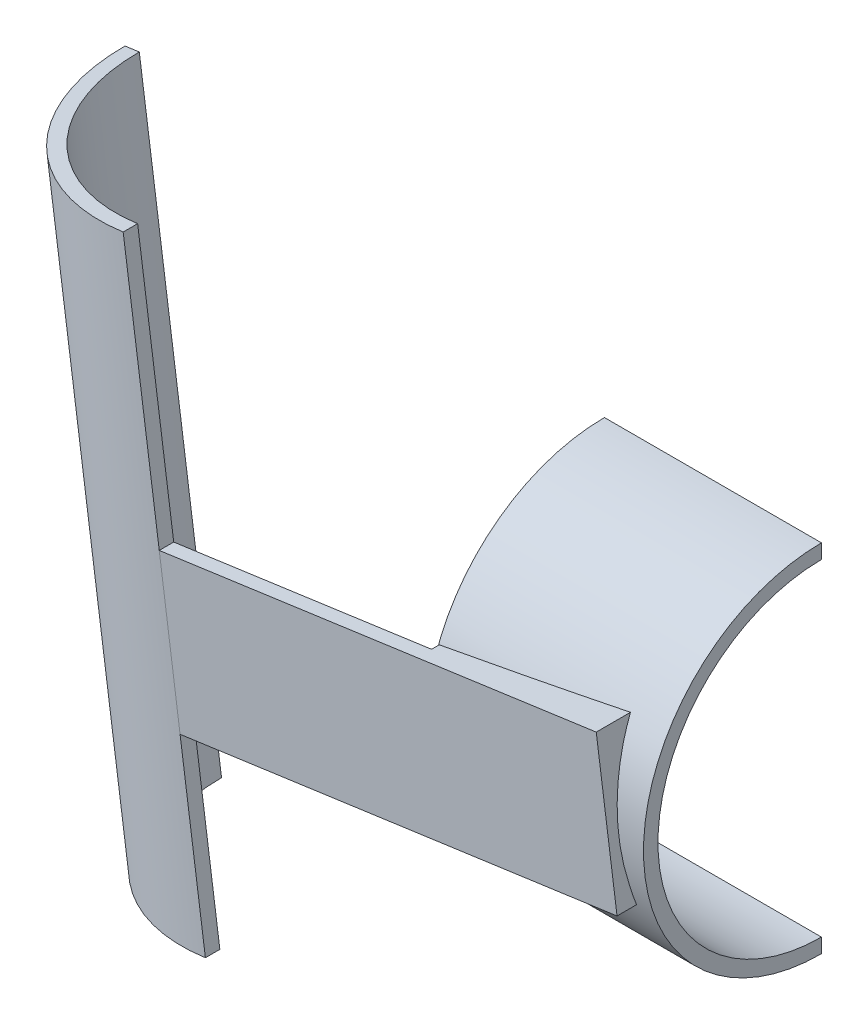
from build123d import *

# Parameters (mm, degrees)
SKETCH3_R               = 26
SKETCH3_R_2             = 24
BOSS_EXTRUDE1_DEPTH     = 82
SKETCH2_R               = 24.6
SKETCH2_R_2             = 22.6
BOSS_EXTRUDE2_DEPTH     = 30
CUT_EXTRUDE1_DEPTH      = 30
CUT_EXTRUDE1_DEPTH_BACK = 30
SKETCH5_W               = 101.816386604
SKETCH5_H               = 90.816460778
CUT_EXTRUDE2_DEPTH      = 30
SKETCH6_W               = 2
SKETCH6_H               = 20.775230247
BOSS_EXTRUDE3_DEPTH     = 61
BOSS_EXTRUDE5_DEPTH     = 25
CUT_EXTRUDE3_START      = -32
SKETCH8_R               = 22.6
CUT_EXTRUDE3_DEPTH      = 32


with BuildPart() as part:
    # Sketch3 → Boss-Extrude1 (new body)
    with BuildSketch(Plane(origin=(-103.870896529, 742.017814767, 0), x_dir=(-0.9903438719336157, -0.13863266326351154, 0), z_dir=(0.13863266326351156, -0.9903438719336158, 0))):
        with Locations((-535.354479902, 0)):
            Circle(SKETCH3_R)
        with Locations((-535.354479902, 0)):
            Circle(SKETCH3_R_2, mode=Mode.SUBTRACT)
    extrude(amount=-BOSS_EXTRUDE1_DEPTH)

    # Sketch4 → Cut-Extrude1 (cut, two sides: drawn at the far end of the back side and taken through both)
    with BuildSketch(Plane.XY.offset(-CUT_EXTRUDE1_DEPTH_BACK)):
        Polygon((414.924769966, 897.597101018), (426.314131953, 816.235432106), (452.063072624, 819.839881351), (440.673710637, 901.201550263), align=None)
    extrude(amount=CUT_EXTRUDE1_DEPTH + CUT_EXTRUDE1_DEPTH_BACK, mode=Mode.SUBTRACT)


with BuildPart() as body_2:
    # Sketch2 → Boss-Extrude2 (new body)
    with BuildSketch(Plane(origin=(455.481917253, 0, 0), x_dir=(0, 0, -1), z_dir=(1, 0, 0))):
        with Locations((0, 857.898759871)):
            Circle(SKETCH2_R)
        with Locations((0, 857.898759871)):
            Circle(SKETCH2_R_2, mode=Mode.SUBTRACT)
    extrude(amount=BOSS_EXTRUDE2_DEPTH)


with BuildPart() as cut_extrude2_tool:
    # Sketch5 → Cut-Extrude2 (new body)
    with BuildSketch(Plane.XY):
        with Locations((437.415428166, 854.729783017)):
            Rectangle(SKETCH5_W, SKETCH5_H)
    extrude(amount=-CUT_EXTRUDE2_DEPTH)


with BuildPart() as part_1:
    add(part.part)

    # Cut-Extrude2: cut by cut_extrude2_tool
    add(cut_extrude2_tool.part, mode=Mode.SUBTRACT)



with BuildPart() as body_2_1:
    add(body_2.part)

    # Cut-Extrude2: cut by cut_extrude2_tool
    add(cut_extrude2_tool.part, mode=Mode.SUBTRACT)


with BuildPart() as part_2:
    add(part_1.part)

    add(body_2_1.part)  # Boss-Extrude3 merges body 2
    # Sketch6 → Boss-Extrude3 (add)
    with BuildSketch(Plane(origin=(530.185028483, 74.217617339, 0), x_dir=(0, 0, -1), z_dir=(0.9903438719336157, 0.13863266326351165, 0))):
        with Locations((-25, 784.889811472)):
            Rectangle(SKETCH6_W, SKETCH6_H)
    extrude(amount=BOSS_EXTRUDE3_DEPTH)

    # Sketch7 → Boss-Extrude5 (add)
    with BuildSketch(Plane(origin=(590.596004671, 82.674209798, 0), x_dir=(0, 0, -1), z_dir=(0.9903438719336163, 0.1386326632635082, 0))):
        with BuildLine():
            Line((-26, 774.502196348), (-26, 795.277426595))
            Line((-26, 795.277426595), (-20.191250984, 795.277426595))
            ThreePointArc((-20.191250984, 795.277426595), (-24.123503055, 785.245711867), (-23.302052486, 774.502196348))
            Line((-23.302052486, 774.502196348), (-26, 774.502196348))
        make_face()
    extrude(amount=-BOSS_EXTRUDE5_DEPTH)

    # Sketch8 → Cut-Extrude3 (cut)
    with BuildSketch(Plane(origin=(485.481917253, 0, 0), x_dir=(0, 0, -1), z_dir=(1, 0, 0)).offset(CUT_EXTRUDE3_START)):
        with Locations((0, 857.898759871)):
            Circle(SKETCH8_R)
    extrude(amount=CUT_EXTRUDE3_DEPTH, mode=Mode.SUBTRACT)


solid = part_2.part
